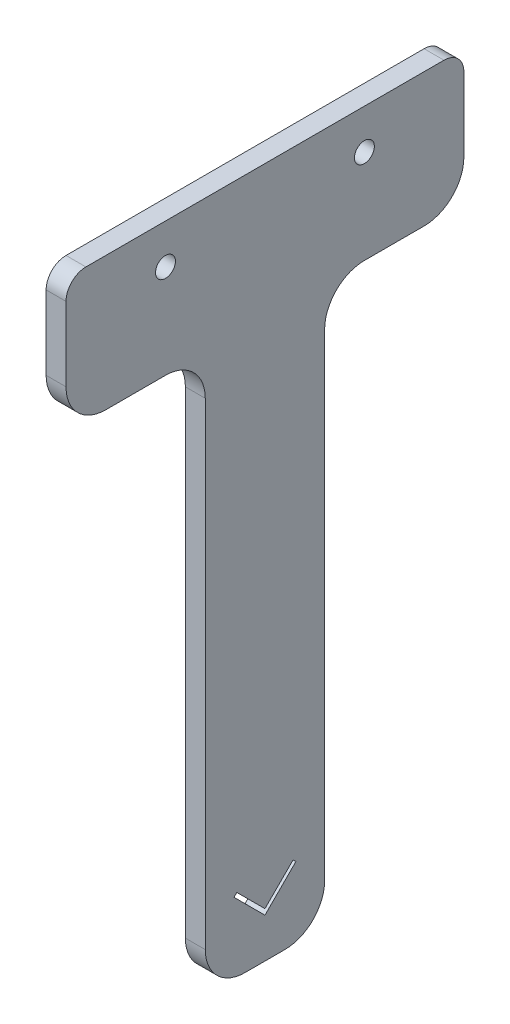
from build123d import *

# Parameters (mm, degrees)
BOSS_EXTRUDE2_DEPTH     = 6.35
CUT_EXTRUDE1_REACH      = 129.376
CUT_EXTRUDE2_DEPTH      = 128.37561853
CUT_EXTRUDE2_DEPTH_BACK = 128.37561853
SKETCH5_R               = 3.175
CUT_EXTRUDE3_DEPTH      = 128.37561853


with BuildPart() as part:
    # Sketch3 → Boss-Extrude2 (new body)
    with BuildSketch(Plane(origin=(0, 0, 0), x_dir=(0, 0, -1), z_dir=(1, 0, 0))):
        with BuildLine():
            Line((-57.15, -110.236), (57.15, -110.236))
            ThreePointArc((57.15, -110.236), (61.640128061, -108.376128061), (63.5, -103.886))
            Line((63.5, -103.886), (63.5, 103.886))
            ThreePointArc((63.5, 103.886), (61.640128061, 108.376128061), (57.15, 110.236))
            Line((57.15, 110.236), (-57.15, 110.236))
            ThreePointArc((-57.15, 110.236), (-61.640128061, 108.376128061), (-63.5, 103.886))
            Line((-63.5, 103.886), (-63.5, -103.886))
            ThreePointArc((-63.5, -103.886), (-61.640128061, -108.376128061), (-57.15, -110.236))
        make_face()
    extrude(amount=BOSS_EXTRUDE2_DEPTH)

    # Sketch4 → Cut-Extrude1 (cut, up to next)
    with BuildSketch(Plane(origin=(6.35, 0, 0), x_dir=(0, 0, -1), z_dir=(1, 0, 0)), mode=Mode.PRIVATE) as cut_extrude1_sk1:
        Polygon((0, -95.739948776), (-8.980256121, -86.759692655), (-9.878281733, -87.657718267), (0, -97.536), (9.878281733, -87.657718267), (8.980256121, -86.759692655), align=None)
    cut_extrude1_tool1 = extrude(cut_extrude1_sk1.sketch, amount=-CUT_EXTRUDE1_REACH, mode=Mode.PRIVATE) & part.part
    add(cut_extrude1_tool1.solids().sort_by_distance((6.35, -91.408951, 4.649259))[0], mode=Mode.SUBTRACT)

    # Sketch5 → Cut-Extrude2 (cut, two sides: drawn at the far end of the back side and taken through both)
    with BuildSketch(Plane(origin=(6.35, 0, 0), x_dir=(0, 0, -1), z_dir=(1, 0, 0)).offset(-CUT_EXTRUDE2_DEPTH_BACK)):
        with Locations((-31.75, 97.536)):
            Circle(SKETCH5_R)
        with Locations((31.75, 97.536)):
            Circle(SKETCH5_R)
    extrude(amount=CUT_EXTRUDE2_DEPTH + CUT_EXTRUDE2_DEPTH_BACK, mode=Mode.SUBTRACT)

    # Sketch6 → Cut-Extrude3 (cut, through all)
    with BuildSketch(Plane(origin=(6.35, 0, 0), x_dir=(0, 0, -1), z_dir=(1, 0, 0))):
        with BuildLine():
            Line((-19.05, -97.536), (-19.05, 54.864))
            ThreePointArc((-19.05, 54.864), (-22.769743879, 63.844256121), (-31.75, 67.564))
            Line((-31.75, 67.564), (-50.8, 67.564))
            ThreePointArc((-50.8, 67.564), (-59.780256121, 71.283743879), (-63.5, 80.264))
            Line((-63.5, 80.264), (-63.5, 67.564))
            Line((-63.5, 67.564), (-63.5, -103.886))
            ThreePointArc((-63.5, -103.886), (-61.640128061, -108.376128061), (-57.15, -110.236))
            Line((-57.15, -110.236), (-19.05, -110.236))
            Line((-19.05, -110.236), (-6.35, -110.236))
            ThreePointArc((-6.35, -110.236), (-15.330256121, -106.516256121), (-19.05, -97.536))
        make_face()
        with BuildLine():
            Line((19.05, -97.536), (19.05, 54.864))
            ThreePointArc((19.05, 54.864), (22.769743879, 63.844256121), (31.75, 67.564))
            Line((31.75, 67.564), (50.8, 67.564))
            ThreePointArc((50.8, 67.564), (59.780256121, 71.283743879), (63.5, 80.264))
            Line((63.5, 80.264), (63.5, 67.564))
            Line((63.5, 67.564), (63.5, -103.886))
            ThreePointArc((63.5, -103.886), (61.640128061, -108.376128061), (57.15, -110.236))
            Line((57.15, -110.236), (19.05, -110.236))
            Line((19.05, -110.236), (6.35, -110.236))
            ThreePointArc((6.35, -110.236), (15.330256121, -106.516256121), (19.05, -97.536))
        make_face()
    extrude(amount=-CUT_EXTRUDE3_DEPTH, mode=Mode.SUBTRACT)


solid = part.part
